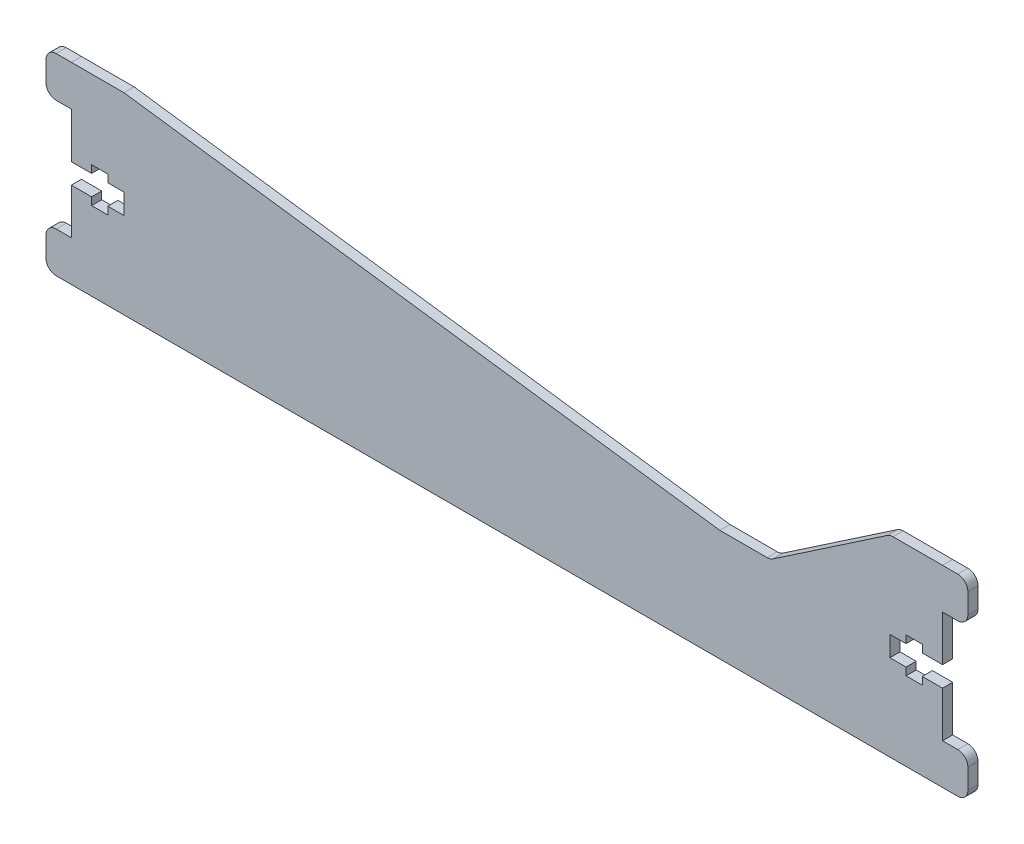
from build123d import *

# Parameters (mm, degrees)
EXTRUDE_1_DEPTH = 2
FILLET_1_R      = 2


with BuildPart() as part:
    # 草图1 → 凸台-拉伸1 (new body)
    with BuildSketch(Plane.XY):
        Polygon((81.505044408, -5.402721296), (76.505044408, -5.402721296), (76.505044408, 3.597278862), (72.505044408, 3.597278862), (72.505044408, 2.097278862), (69.305044408, 2.097278862), (69.305044408, 3.597278862), (66.105044408, 3.597278862), (66.105044408, 7.597278862), (69.305044408, 7.597278862), (69.305044408, 9.097278862), (72.505044408, 9.097278862), (72.505044408, 7.597278862), (76.505044408, 7.597278862), (76.505044408, 16.59727902), (81.505044408, 16.59727902), (81.505044408, 24.59727902), (76.505044688, 24.595607728), (66.105044408, 24.595607728), (42.505044408, 8.595607728), (32.535817857, 8.595607728), (-85.094955033, 24.595607728), (-95.494955312, 24.595607728), (-100.494955033, 24.59727902), (-100.494955033, 16.59727902), (-95.494955033, 16.59727902), (-95.494955033, 7.597278862), (-91.494955033, 7.597278862), (-91.494955033, 9.097278862), (-88.294955033, 9.097278862), (-88.294955033, 7.597278862), (-85.094955033, 7.597278862), (-85.094955033, 3.597278862), (-88.294955033, 3.597278862), (-88.294955033, 2.097278862), (-91.494955033, 2.097278862), (-91.494955033, 3.597278862), (-95.494955033, 3.597278862), (-95.494955033, -5.402721296), (-100.494955033, -5.402721296), (-100.494955033, -13.402721296), (-95.494955312, -13.401050004), (76.505044688, -13.401050004), (81.505044408, -13.402721296), align=None)
    extrude(amount=EXTRUDE_1_DEPTH)

    # 圆角1
    fillet_1_edges = [part.edges().sort_by_distance(p)[0] for p in [
        (42.505044408, 8.595607728, 1),
        (66.105044408, 24.595607728, 1),
        (81.505044408, 24.59727902, 1),
        (81.505044408, 16.59727902, 1),
        (81.505044408, -5.402721296, 1),
        (81.505044408, -13.402721296, 1),
        (-100.494955033, -13.402721296, 1),
        (-100.494955033, -5.402721296, 1),
        (-100.494955033, 16.59727902, 1),
        (-100.494955033, 24.59727902, 1),
    ]]
    fillet(fillet_1_edges, radius=FILLET_1_R)


solid = part.part
